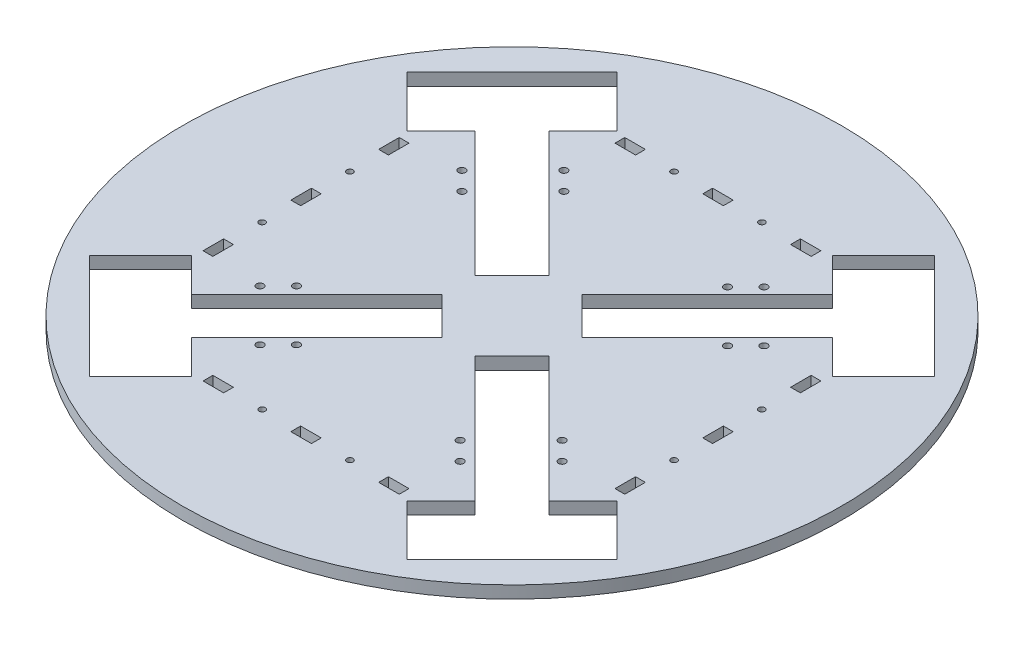
from build123d import *

# Parameters (mm, degrees)
SKETCH1_R           = 160
BOSS_EXTRUDE1_DEPTH = 6
CUT_EXTRUDE1_DEPTH  = 368.744476505
CUT_EXTRUDE2_DEPTH  = 368.744476505
SKETCH7_R           = 1.75
CUT_EXTRUDE3_DEPTH  = 368.744476505
SKETCH9_R           = 1.5
SKETCH9_W           = 4.75
SKETCH9_H           = 10
SKETCH9_W_2         = 10
SKETCH9_H_2         = 4.75
CUT_EXTRUDE4_DEPTH  = 368.744476505


with BuildPart() as part:
    # Sketch1 → Boss-Extrude1 (new body)
    with BuildSketch(Plane(origin=(0, 0, 0), x_dir=(1, 0, 0), z_dir=(0, 1, 0))):
        with Locations(Location((-100, 100, 0), (0, 0, 270))):
            Circle(SKETCH1_R)
    extrude(amount=BOSS_EXTRUDE1_DEPTH)

    # Sketch3 → Cut-Extrude1 (cut, through all)
    with BuildSketch(Plane.XZ):
        Polygon((-22.925360851, -227.986327395), (-47.674098192, -203.237590053), (3.237590053, -152.325901808), (27.986327395, -177.074639149), align=None)
        Polygon((3.237590053, -47.674098192), (27.986327395, -22.925360851), (-22.925360851, 27.986327395), (-47.674098192, 3.237590053), align=None)
        Polygon((-152.325901808, 3.237590053), (-177.074639149, 27.986327395), (-227.986327395, -22.925360851), (-203.237590053, -47.674098192), align=None)
        Polygon((-177.074639149, -227.986327395), (-152.325901808, -203.237590053), (-203.237590053, -152.325901808), (-227.986327395, -177.074639149), align=None)
    extrude(amount=-CUT_EXTRUDE1_DEPTH, mode=Mode.SUBTRACT)

    # Sketch4 → Cut-Extrude2 (cut, through all)
    with BuildSketch(Plane.XZ):
        Polygon((-31.23386553, -186.797357391), (-13.202642609, -168.76613447), (-74.013825791, -107.954951288), (-92.045048712, -125.986174209), align=None)
        Polygon((-125.986174209, -107.954951288), (-186.797357391, -168.76613447), (-168.76613447, -186.797357391), (-107.954951288, -125.986174209), align=None)
        Polygon((-107.954951288, -74.013825791), (-168.76613447, -13.202642609), (-186.797357391, -31.23386553), (-125.986174209, -92.045048712), align=None)
        Polygon((-74.013825791, -92.045048712), (-13.202642609, -31.23386553), (-31.23386553, -13.202642609), (-92.045048712, -74.013825791), align=None)
    extrude(amount=-CUT_EXTRUDE2_DEPTH, mode=Mode.SUBTRACT)

    # Sketch7 → Cut-Extrude3 (cut, through all)
    with BuildSketch(Plane.XZ):
        with Locations(Location((-149.002499936, -26.673026791, 0), (0, 0, 270))):
            Circle(SKETCH7_R)
        with Locations(Location((-148.578235868, -173.751237278, 0), (0, 0, 270))):
            Circle(SKETCH7_R)
        with Locations(Location((-140.163665171, -35.511861556, 0), (0, 0, 270))):
            Circle(SKETCH7_R)
        with Locations(Location((-164.912402513, -60.260598897, 0), (0, 0, 270))):
            Circle(SKETCH7_R)
        with Locations(Location((-173.751237278, -51.421764132, 0), (0, 0, 270))):
            Circle(SKETCH7_R)
        with Locations(Location((-173.326973209, -149.002499936, 0), (0, 0, 270))):
            Circle(SKETCH7_R)
        with Locations(Location((-164.488138444, -140.163665171, 0), (0, 0, 270))):
            Circle(SKETCH7_R)
        with Locations(Location((-139.739401103, -164.912402513, 0), (0, 0, 270))):
            Circle(SKETCH7_R)
        with Locations(Location((-26.673026791, -50.997500064, 0), (0, 0, 270))):
            Circle(SKETCH7_R)
        with Locations(Location((-35.511861556, -59.836334829, 0), (0, 0, 270))):
            Circle(SKETCH7_R)
        with Locations(Location((-60.260598897, -35.087597487, 0), (0, 0, 270))):
            Circle(SKETCH7_R)
        with Locations(Location((-51.421764132, -26.248762722, 0), (0, 0, 270))):
            Circle(SKETCH7_R)
        with Locations(Location((-50.997500064, -173.326973209, 0), (0, 0, 270))):
            Circle(SKETCH7_R)
        with Locations(Location((-59.836334829, -164.488138444, 0), (0, 0, 270))):
            Circle(SKETCH7_R)
        with Locations(Location((-35.087597487, -139.739401103, 0), (0, 0, 270))):
            Circle(SKETCH7_R)
        with Locations(Location((-26.248762722, -148.578235868, 0), (0, 0, 270))):
            Circle(SKETCH7_R)
    extrude(amount=-CUT_EXTRUDE3_DEPTH, mode=Mode.SUBTRACT)

    # Sketch9 → Cut-Extrude4 (cut, through all)
    with BuildSketch(Plane.XZ):
        with Locations(Location((0, -78.6875, 0), (0, 0, 270))):
            Circle(SKETCH9_R)
        with Locations(Location((0, -121.3125, 0), (0, 0, 270))):
            Circle(SKETCH9_R)
        with Locations(Location((-78.6875, -200, 0), (0, 0, 270))):
            Circle(SKETCH9_R)
        with Locations(Location((-121.3125, -200, 0), (0, 0, 270))):
            Circle(SKETCH9_R)
        with Locations(Location((-200, -121.3125, 0), (0, 0, 270))):
            Circle(SKETCH9_R)
        with Locations(Location((-200, -78.6875, 0), (0, 0, 270))):
            Circle(SKETCH9_R)
        with Locations(Location((-121.3125, 0, 0), (0, 0, 270))):
            Circle(SKETCH9_R)
        with Locations(Location((-78.6875, 0, 0), (0, 0, 270))):
            Circle(SKETCH9_R)
        with Locations((0, -142.625)):
            Rectangle(SKETCH9_W, SKETCH9_H)
        with Locations((0, -100)):
            Rectangle(SKETCH9_W, SKETCH9_H)
        with Locations((0, -57.375)):
            Rectangle(SKETCH9_W, SKETCH9_H)
        with Locations((-100, -200)):
            Rectangle(SKETCH9_W_2, SKETCH9_H_2)
        with Locations((-57.375, -200)):
            Rectangle(SKETCH9_W_2, SKETCH9_H_2)
        with Locations((-142.625, -200)):
            Rectangle(SKETCH9_W_2, SKETCH9_H_2)
        with Locations((-200, -100)):
            Rectangle(SKETCH9_W, SKETCH9_H)
        with Locations((-200, -142.625)):
            Rectangle(SKETCH9_W, SKETCH9_H)
        with Locations((-200, -57.375)):
            Rectangle(SKETCH9_W, SKETCH9_H)
        with Locations((-100, 0)):
            Rectangle(SKETCH9_W_2, SKETCH9_H_2)
        with Locations((-142.625, 0)):
            Rectangle(SKETCH9_W_2, SKETCH9_H_2)
        with Locations((-57.375, 0)):
            Rectangle(SKETCH9_W_2, SKETCH9_H_2)
    extrude(amount=-CUT_EXTRUDE4_DEPTH, mode=Mode.SUBTRACT)


solid = part.part
